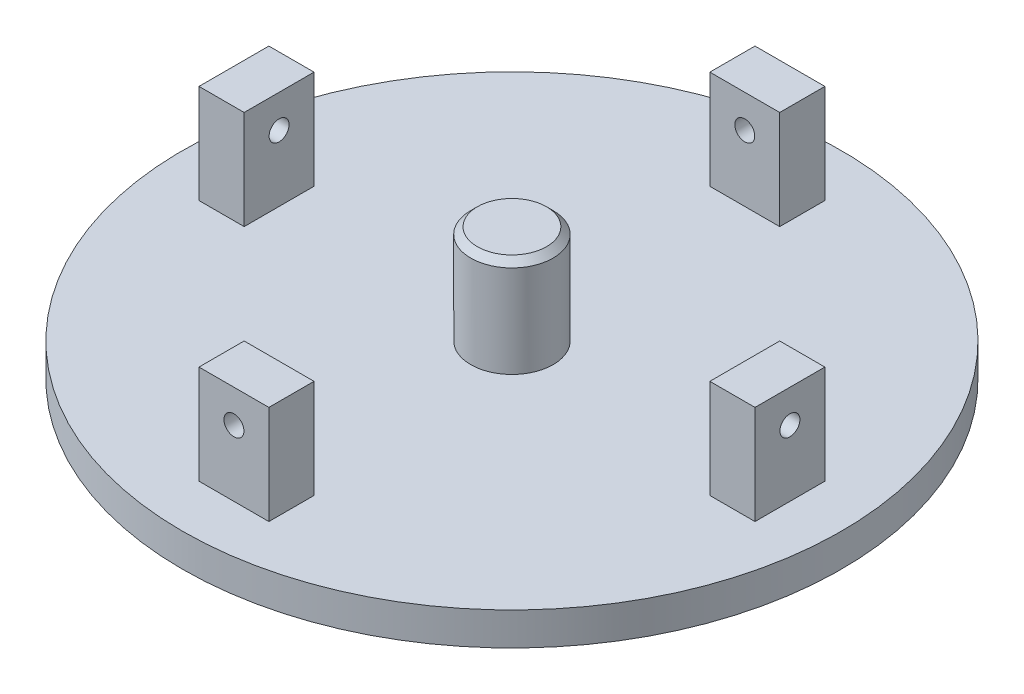
from build123d import *

# Parameters (mm, degrees)
SKETCH1_R           = 100
BOSS_EXTRUDE1_DEPTH = 10
SKETCH2_W           = 21.2
SKETCH2_H           = 13.7
SKETCH2_W_2         = 13.7
SKETCH2_H_2         = 21.2
BOSS_EXTRUDE2_DEPTH = 30
SKETCH3_R           = 3.025
CUT_EXTRUDE1_DEPTH  = 190
SKETCH4_R           = 3.025
CUT_EXTRUDE2_DEPTH  = 190
SKETCH5_R           = 12.5
BOSS_EXTRUDE3_DEPTH = 30
CHAMFER1_SIZE       = 2


with BuildPart() as part:
    # Sketch1 → Boss-Extrude1 (new body)
    with BuildSketch(Plane(origin=(0, 0, 0), x_dir=(1, 0, 0), z_dir=(0, 1, 0))):
        with Locations(Location((0, 0, 0), (0, 0, 270))):
            Circle(SKETCH1_R)
    extrude(amount=BOSS_EXTRUDE1_DEPTH)

    # Sketch2 → Boss-Extrude2 (add)
    with BuildSketch(Plane(origin=(0, 10, 0), x_dir=(1, 0, 0), z_dir=(0, 1, 0))):
        with Locations((0, -77.5)):
            Rectangle(SKETCH2_W, SKETCH2_H)
        with Locations((77.5, 0)):
            Rectangle(SKETCH2_W_2, SKETCH2_H_2)
        with Locations((-77.5, 0)):
            Rectangle(SKETCH2_W_2, SKETCH2_H_2)
        with Locations((0, 77.5)):
            Rectangle(SKETCH2_W, SKETCH2_H)
    extrude(amount=BOSS_EXTRUDE2_DEPTH)

    # Sketch3 → Cut-Extrude1 (cut)
    with BuildSketch(Plane.ZY.offset(84.35)):
        with Locations((0, 30)):
            Circle(SKETCH3_R)
    extrude(amount=-CUT_EXTRUDE1_DEPTH, mode=Mode.SUBTRACT)

    # Sketch4 → Cut-Extrude2 (cut)
    with BuildSketch(Plane.XY.offset(84.35)):
        with Locations((0, 30)):
            Circle(SKETCH4_R)
    extrude(amount=-CUT_EXTRUDE2_DEPTH, mode=Mode.SUBTRACT)

    # Sketch5 → Boss-Extrude3 (add)
    with BuildSketch(Plane(origin=(0, 10, 0), x_dir=(1, 0, 0), z_dir=(0, 1, 0))):
        with Locations(Location((0, 0, 0), (0, 0, 90))):
            Circle(SKETCH5_R)
    extrude(amount=BOSS_EXTRUDE3_DEPTH)

    # Chamfer1
    chamfer1_edges = [part.edges().sort_by_distance(p)[0] for p in [
        (0, 40, 12.5),
    ]]
    chamfer(chamfer1_edges, length=CHAMFER1_SIZE)


solid = part.part
